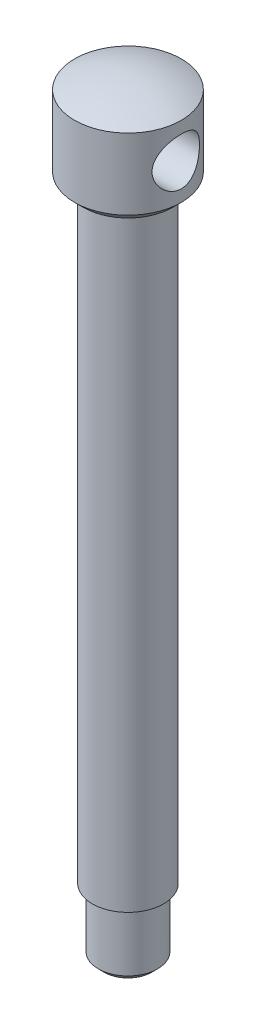
from build123d import *

# Parameters (mm, degrees)
SKETCH1_R               = 18
BOSS_EXTRUDE1_DEPTH     = 24
CUT_EXTRUDE1_DEPTH      = 24
CUT_EXTRUDE1_DEPTH_BACK = 24
SKETCH2_R               = 8
DOME1_FACE_RADIUS       = 18
DOME1_HEIGHT            = 4
SKETCH5_R               = 12
BOSS_EXTRUDE3_DEPTH     = 208
SKETCH13_R              = 10
BOSS_EXTRUDE4_DEPTH     = 20
M8_TAPPED_HOLE1_D       = 6.8
M8_TAPPED_HOLE1_DEPTH   = 20
M8_TAPPED_HOLE1_TIP     = 2.042926105


with BuildPart() as part:
    # Sketch1 → Boss-Extrude1 (new body)
    with BuildSketch(Plane(origin=(0, 0, 0), x_dir=(1, 0, 0), z_dir=(0, 1, 0))):
        with Locations(Location((0, 0, 0), (0, 0, 270))):
            Circle(SKETCH1_R)
    extrude(amount=BOSS_EXTRUDE1_DEPTH)

    # Sketch2 → Cut-Extrude1 (cut, two sides: drawn at the far end of the back side and taken through both)
    with BuildSketch(Plane(origin=(0, 0, 0), x_dir=(0, 0, -1), z_dir=(1, 0, 0)).offset(-CUT_EXTRUDE1_DEPTH_BACK)):
        with Locations(Location((0, 12, 0), (0, 0, 180))):
            Circle(SKETCH2_R)
    extrude(amount=CUT_EXTRUDE1_DEPTH + CUT_EXTRUDE1_DEPTH_BACK, mode=Mode.SUBTRACT)

    # Dome1: a dome of height H over a round flat face of radius A is a cap of a sphere of radius (A * A + H * H) / (2 * H)
    dome1_r = (DOME1_FACE_RADIUS * DOME1_FACE_RADIUS + DOME1_HEIGHT * DOME1_HEIGHT) / (2 * DOME1_HEIGHT)
    dome1_base = Plane((0, 24, 0), z_dir=(0, 1, 0))
    with Locations(dome1_base.offset(DOME1_HEIGHT - dome1_r)):
        dome1_ball = Sphere(dome1_r, mode=Mode.PRIVATE)
    add(split(dome1_ball, bisect_by=dome1_base, keep=Keep.TOP, mode=Mode.PRIVATE))

    # Sketch3 → Revolve1 (revolve)
    with BuildSketch(Plane(origin=(0, 0, 0), x_dir=(0, 0, -1), z_dir=(1, 0, 0)), mode=Mode.PRIVATE) as revolve1_sk:
        Polygon((0, 0), (0, -2.828427125), (15.171572875, -2.828427125), (18, 0), align=None)
    revolve(revolve1_sk.sketch.rotate(Axis((0, 0, 0), (0, -1, 0)), 180), axis=Axis((0, 0, 0), (0, -1, 0)))

    # Sketch5 → Boss-Extrude3 (add)
    with BuildSketch(Plane(origin=(0, 0, 0), x_dir=(1, 0, 0), z_dir=(0, 1, 0))):
        with Locations(Location((0, 0, 0), (0, 0, 270))):
            Circle(SKETCH5_R)
    extrude(amount=-BOSS_EXTRUDE3_DEPTH)

    # Sketch13 → Boss-Extrude4 (add)
    with BuildSketch(Plane(origin=(0, -208, 0), x_dir=(-1, 0, 0), z_dir=(0, -1, 0))):
        with Locations(Location((0, 0, 0), (0, 0, 270))):
            Circle(SKETCH13_R)
    extrude(amount=BOSS_EXTRUDE4_DEPTH)

    # Sketch14 → Revolve2 (revolve)
    with BuildSketch(Plane(origin=(0, 0, 0), x_dir=(0, 0, -1), z_dir=(1, 0, 0))):
        Polygon((0, -228), (0, -230), (-8, -230), (-10, -228), align=None)
    revolve(axis=Axis((0, -228, 0), (0, -1, 0)))

    # M8 Tapped Hole1
    with Locations(Plane(origin=(0, -230, 0), x_dir=(-1, 0, 0), z_dir=(0, -1, 0))):
        with Locations((0, 0)):
            Hole(M8_TAPPED_HOLE1_D / 2, depth=M8_TAPPED_HOLE1_DEPTH)
            with Locations((0, 0, -(M8_TAPPED_HOLE1_DEPTH + M8_TAPPED_HOLE1_TIP / 2))):  # 118° drill point
                Cone(0, M8_TAPPED_HOLE1_D / 2, M8_TAPPED_HOLE1_TIP, mode=Mode.SUBTRACT)


solid = part.part
